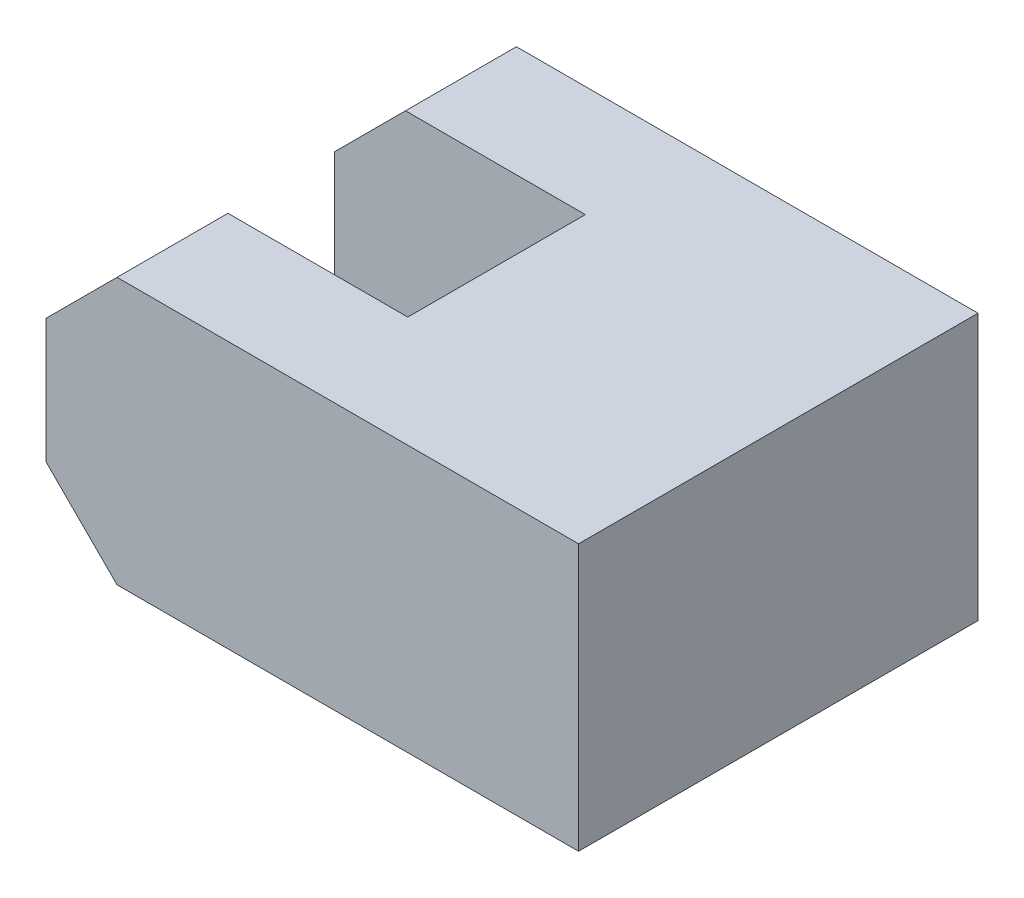
from build123d import *

# Parameters (mm, degrees)
SKETCH_1_W          = 60
SKETCH_1_H          = 45
EXTRUDE_1_DEPTH     = 30
SKETCH_3_W          = 35.871207779
SKETCH_3_H          = 20
CUT_EXTRUDE_3_DEPTH = 62.71805709
CHAMFER_1_SIZE      = 8


with BuildPart() as part:
    # Эскиз1 → Вытянуть1 (new body)
    with BuildSketch(Plane(origin=(0, 0, 0), x_dir=(1, 0, 0), z_dir=(0, 1, 0))):
        with Locations((-19.019063342, 0)):
            Rectangle(SKETCH_1_W, SKETCH_1_H)
    extrude(amount=EXTRUDE_1_DEPTH)

    # Эскиз3 → Вытянуть3 (cut, through all)
    with BuildSketch(Plane(origin=(0, 30, 0), x_dir=(1, 0, 0), z_dir=(0, 1, 0))):
        with Locations((-38.69487705, 0)):
            Rectangle(SKETCH_3_W, SKETCH_3_H)
    extrude(amount=-CUT_EXTRUDE_3_DEPTH, mode=Mode.SUBTRACT)

    # Фаска1
    chamfer_1_edges = [part.edges().sort_by_distance(p)[0] for p in [
        (-49.019063342, 30, -16.25),
        (-49.019063342, 0, 16.25),
        (-49.019063342, 30, 16.25),
        (-49.019063342, 0, -16.25),
    ]]
    chamfer(chamfer_1_edges, length=CHAMFER_1_SIZE)


solid = part.part
